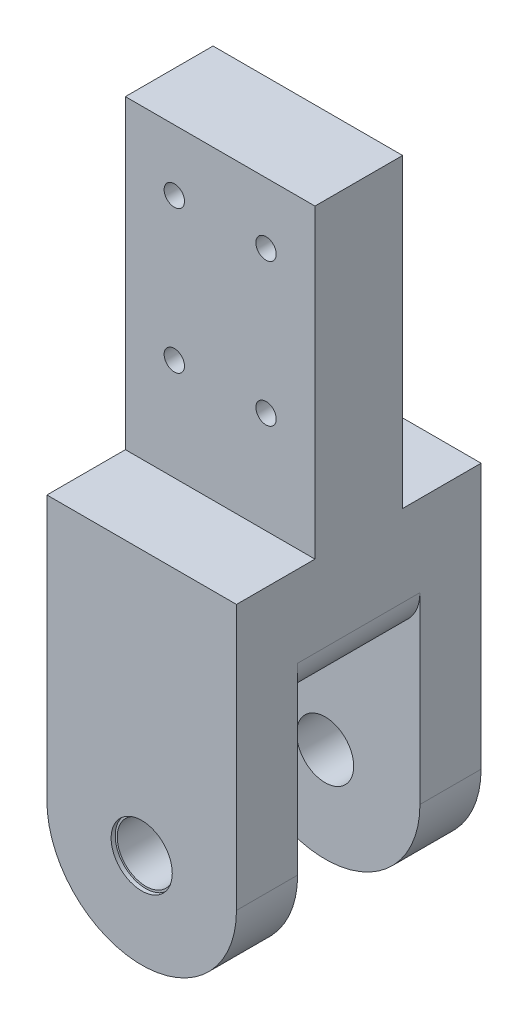
from build123d import *

# Parameters (mm, degrees)
SKETCH1_R           = 7
SKETCH1_R_2         = 2.5
BOSS_EXTRUDE1_DEPTH = 30
SKETCH2_W           = 30
SKETCH2_H           = 58.25
CUT_EXTRUDE1_DEPTH  = 151.539861831
SKETCH3_R           = 7.5
CUT_EXTRUDE2_DEPTH  = 1
CUT_EXTRUDE3_START  = -1
SKETCH4_R           = 7.5
CUT_EXTRUDE3_DEPTH  = 1
SKETCH6_W           = 17.3
SKETCH6_H           = 75
CUT_EXTRUDE4_DEPTH  = 151.539861831
SKETCH7_W           = 46.5
SKETCH7_H           = 1.95
CUT_EXTRUDE5_DEPTH  = 97.065732704
FILLET1_R           = 10


with BuildPart() as part:
    # Sketch1 → Boss-Extrude1 (new, symmetric)
    with BuildSketch(Plane.XY):
        with BuildLine():
            Line((-23.25, 0), (-23.25, 140))
            Line((-23.25, 140), (23.25, 140))
            Line((23.25, 140), (23.25, 0))
            ThreePointArc((23.25, 0), (0, -23.25), (-23.25, 0))
        make_face()
        Circle(SKETCH1_R, mode=Mode.SUBTRACT)
        with Locations((-11.25, 125)):
            Circle(SKETCH1_R_2, mode=Mode.SUBTRACT)
        with Locations((11.25, 125)):
            Circle(SKETCH1_R_2, mode=Mode.SUBTRACT)
        with Locations((11.25, 90)):
            Circle(SKETCH1_R_2, mode=Mode.SUBTRACT)
        with Locations((-11.25, 90)):
            Circle(SKETCH1_R_2, mode=Mode.SUBTRACT)
    extrude(amount=BOSS_EXTRUDE1_DEPTH, both=True)

    # Sketch2 → Cut-Extrude1 (cut, through all)
    with BuildSketch(Plane(origin=(23.25, 0, 0), x_dir=(0, 0, -1), z_dir=(1, 0, 0))):
        with Locations((0, 5.875)):
            Rectangle(SKETCH2_W, SKETCH2_H)
    extrude(amount=-CUT_EXTRUDE1_DEPTH, mode=Mode.SUBTRACT)

    # Sketch3 → Cut-Extrude2 (cut)
    with BuildSketch(Plane.XY.offset(30)):
        Circle(SKETCH3_R)
    extrude(amount=-CUT_EXTRUDE2_DEPTH, mode=Mode.SUBTRACT)

    # Sketch4 → Cut-Extrude3 (cut)
    with BuildSketch(Plane(origin=(0, 0, -30), x_dir=(-1, 0, 0), z_dir=(0, 0, -1)).offset(CUT_EXTRUDE3_START)):
        with Locations(Location((0, 0, 0), (0, 0, 180))):
            Circle(SKETCH4_R)
    extrude(amount=CUT_EXTRUDE3_DEPTH, mode=Mode.SUBTRACT)

    # Sketch6 → Cut-Extrude4 (cut, through all)
    with BuildSketch(Plane(origin=(23.25, 0, 0), x_dir=(0, 0, -1), z_dir=(1, 0, 0))):
        with Locations((-21.35, 102.5)):
            Rectangle(SKETCH6_W, SKETCH6_H)
        with Locations((21.35, 102.5)):
            Rectangle(SKETCH6_W, SKETCH6_H)
    extrude(amount=-CUT_EXTRUDE4_DEPTH, mode=Mode.SUBTRACT)

    # Sketch7 → Cut-Extrude5 (cut, through all)
    with BuildSketch(Plane(origin=(0, 65, 0), x_dir=(1, 0, 0), z_dir=(0, 1, 0))):
        with Locations((0, 11.725)):
            Rectangle(SKETCH7_W, SKETCH7_H)
        with Locations((0, -11.725)):
            Rectangle(SKETCH7_W, SKETCH7_H)
    extrude(amount=CUT_EXTRUDE5_DEPTH, mode=Mode.SUBTRACT)

    # Fillet1
    fillet1_edges = [part.edges().sort_by_distance(p)[0] for p in [
        (23.25, 35, 0),
        (-23.25, 35, 0),
    ]]
    fillet(fillet1_edges, radius=FILLET1_R)


solid = part.part
